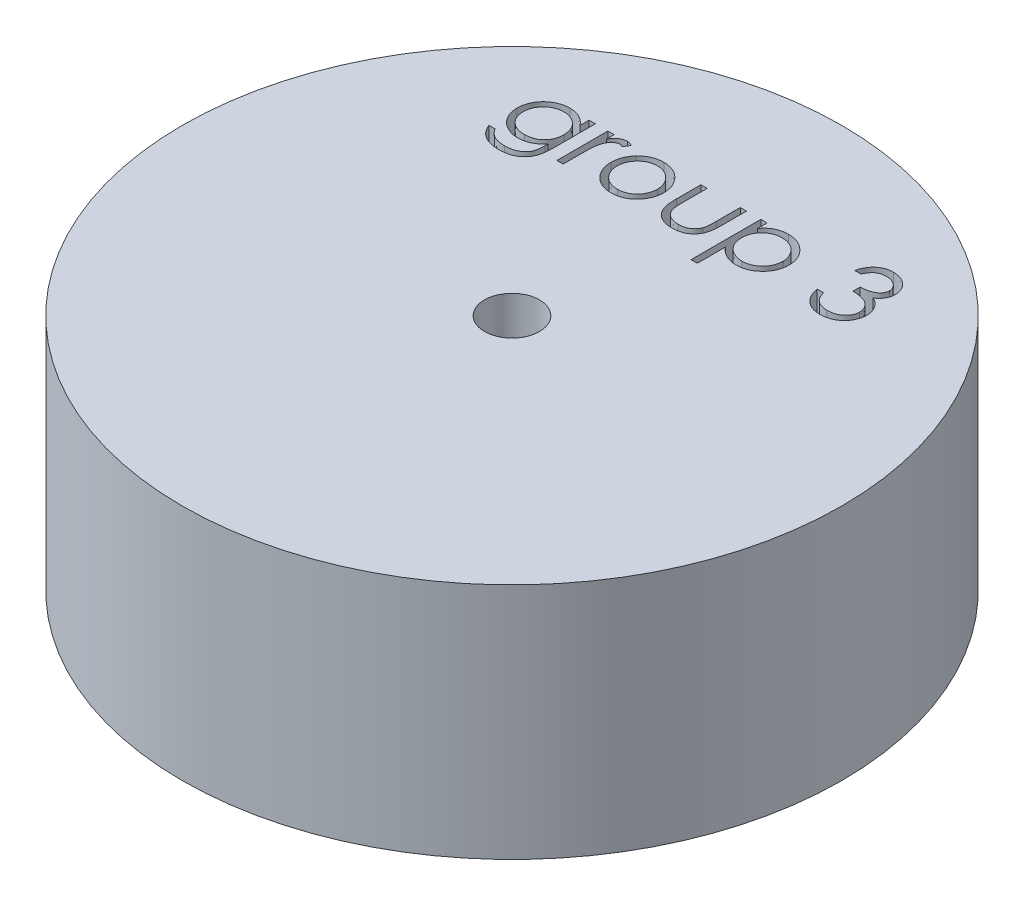
from build123d import *

# Parameters (mm, degrees)
SKETCH1_R           = 15
BOSS_EXTRUDE2_DEPTH = 10.82
SKETCH2_R           = 1.25
CUT_EXTRUDE1_DEPTH  = 7.65
CUT_EXTRUDE2_DEPTH  = 2


with BuildPart() as part:
    # Sketch1 → Boss-Extrude2 (new body)
    with BuildSketch(Plane(origin=(0, 0, 0), x_dir=(1, 0, 0), z_dir=(0, 1, 0))):
        with Locations(Location((0, 0, 0), (0, 0, 270))):
            Circle(SKETCH1_R)
    extrude(amount=BOSS_EXTRUDE2_DEPTH)

    # Sketch2 → Cut-Extrude1 (cut)
    with BuildSketch(Plane(origin=(0, 10.82, 0), x_dir=(1, 0, 0), z_dir=(0, 1, 0))):
        with Locations(Location((0, 0, 0), (0, 0, 270))):
            Circle(SKETCH2_R)
    extrude(amount=-CUT_EXTRUDE1_DEPTH, mode=Mode.SUBTRACT)

    # Sketch3 → Cut-Extrude2 (cut)
    # profile 1 of 6: a face of its own
    with BuildSketch(Plane(origin=(0, 10.82, 0), x_dir=(1, 0, 0), z_dir=(0, 1, 0))):
        with BuildLine():
            Line((-5.949999739, 9.456250615), (-5.665063841, 9.456250615))
            Line((-5.665063841, 9.456250615), (-5.665063841, 7.614979581))
            add(Edge.make_bspline(
                [(-5.665063841, 7.614979581), (-5.665315158, 7.575756906), (-5.665800261, 7.500047695), (-5.669293642, 7.390575255), (-5.676660256, 7.289459592), (-5.685013846, 7.196239543), (-5.69703051, 7.111347201), (-5.711704786, 7.034529251), (-5.728247152, 6.965711976), (-5.742779778, 6.92332587), (-5.749654186, 6.903275855)],
                knots=[0, 0, 0, 0, 1.307562039, 2.523909702, 3.650326591, 4.686913197, 5.643429486, 6.506965704, 7.293745905, 8, 8, 8, 8], degree=3))
            add(Edge.make_bspline(
                [(-5.749654186, 6.903275855), (-5.759804424, 6.877213712), (-5.779801414, 6.825868667), (-5.817253382, 6.753084676), (-5.859194137, 6.684553308), (-5.907097404, 6.620656477), (-5.960746562, 6.561714949), (-6.018877629, 6.506448179), (-6.082622732, 6.456025398), (-6.151945421, 6.411316593), (-6.225247674, 6.371051193), (-6.302487352, 6.336174665), (-6.383228907, 6.305797314), (-6.468230815, 6.283043635), (-6.556160385, 6.263327138), (-6.648051626, 6.250495887), (-6.743367663, 6.24176277), (-6.80817883, 6.240955202), (-6.841060436, 6.240545486)],
                knots=[0, 0, 0, 0, 0.981931301, 1.934503488, 2.87077864, 3.801706999, 4.735015492, 5.667491629, 6.616593066, 7.585388521, 8.561939025, 9.551802639, 10.560317337, 11.588439944, 12.640189604, 13.723962949, 14.845264515, 16, 16, 16, 16], degree=3))
            add(Edge.make_bspline(
                [(-6.841060436, 6.240545486), (-6.889034445, 6.241322441), (-6.982740574, 6.242840043), (-7.119360817, 6.260521088), (-7.249113742, 6.28551684), (-7.370284856, 6.323349621), (-7.482108444, 6.369647462), (-7.583820817, 6.422801455), (-7.674508893, 6.483751756), (-7.756263939, 6.55314873), (-7.830052382, 6.635665784), (-7.899473566, 6.73291045), (-7.966294563, 6.846363985), (-8.005454685, 6.929633089), (-8.025961277, 6.973237794)],
                knots=[0, 0, 0, 0, 1.157897085, 2.2616841, 3.32207898, 4.345638746, 5.321241055, 6.241986252, 7.112515963, 7.955008012, 8.825025602, 9.77857164, 10.836726669, 12, 12, 12, 12], degree=3))
            Line((-8.025961277, 6.973237794), (-7.74102538, 6.973237794))
            add(Edge.make_bspline(
                [(-7.74102538, 6.973237794), (-7.718108947, 6.936856035), (-7.673310143, 6.865734177), (-7.589536878, 6.773647243), (-7.497728282, 6.694949548), (-7.394785998, 6.631530488), (-7.280281695, 6.583715177), (-7.154146487, 6.549629016), (-7.015353973, 6.529221688), (-6.918726736, 6.526762157), (-6.868409194, 6.525481384)],
                knots=[0, 0, 0, 0, 0.997731894, 1.950442991, 2.880492273, 3.800895997, 4.748200782, 5.754801363, 6.83083817, 8, 8, 8, 8], degree=3))
            add(Edge.make_bspline(
                [(-6.868409194, 6.525481384), (-6.8187278, 6.526778733), (-6.722947047, 6.529279893), (-6.585214486, 6.549638123), (-6.459489078, 6.583722595), (-6.346495182, 6.631445917), (-6.24756602, 6.689911643), (-6.162283714, 6.755225996), (-6.093209615, 6.828868763), (-6.046752138, 6.896706545), (-6.017873592, 6.957144148), (-5.999483777, 7.009171146), (-5.984539534, 7.06800197), (-5.972039252, 7.133439388), (-5.96172421, 7.205576892), (-5.955190166, 7.284579422), (-5.950467751, 7.370267431), (-5.95015935, 7.429679063), (-5.949999739, 7.460427297)],
                knots=[0, 0, 0, 0, 1.570740765, 3.028230971, 4.391408896, 5.680370741, 6.894727393, 8.017376726, 9.065722033, 10.075533815, 10.603371122, 11.180248986, 11.817768598, 12.521299649, 13.286540596, 14.121245857, 15.027658897, 16, 16, 16, 16], degree=3))
            Line((-5.949999739, 7.460427297), (-5.949999739, 7.580634629))
            add(Edge.make_bspline(
                [(-5.949999739, 7.580634629), (-5.978920466, 7.546215994), (-6.036253216, 7.477984138), (-6.135265434, 7.388574653), (-6.243412207, 7.311570806), (-6.360509421, 7.248416759), (-6.483688755, 7.197905753), (-6.611616064, 7.162578924), (-6.743144571, 7.1397553), (-6.832273307, 7.137299378), (-6.87731344, 7.136058307)],
                knots=[0, 0, 0, 0, 1.012485704, 2.007162095, 2.997754123, 3.998611389, 4.999708251, 5.992315798, 6.98544096, 8, 8, 8, 8], degree=3))
            add(Edge.make_bspline(
                [(-6.87731344, 7.136058307), (-6.903834913, 7.136525509), (-6.956564005, 7.137454386), (-7.034900097, 7.145581277), (-7.112080209, 7.157372993), (-7.18792434, 7.174682584), (-7.262541932, 7.196900079), (-7.335809676, 7.224673835), (-7.408320804, 7.256074692), (-7.47875727, 7.293061449), (-7.546417546, 7.334211542), (-7.610791292, 7.378787536), (-7.671541324, 7.426556126), (-7.728089425, 7.47798835), (-7.78036142, 7.533009769), (-7.829060357, 7.591033849), (-7.873380951, 7.652870821), (-7.914232668, 7.717393133), (-7.949663446, 7.785030542), (-7.980764269, 7.854316386), (-8.007805658, 7.925102516), (-8.029364272, 7.997625923), (-8.045829925, 8.071840885), (-8.058085631, 8.147625821), (-8.065037005, 8.225214101), (-8.066120971, 8.277484896), (-8.066666405, 8.303786672)],
                knots=[0, 0, 0, 0, 1.028754217, 2.045334182, 3.052854819, 4.056607503, 5.061168794, 6.071104265, 7.095078842, 8.125279047, 9.155117945, 10.165957491, 11.161587969, 12.151493252, 13.128948131, 14.104219989, 15.088194871, 16.07871515, 17.064853787, 18.047899887, 19.02414258, 20.002704429, 20.980574569, 21.971845993, 22.979467364, 24, 24, 24, 24], degree=3))
            add(Edge.make_bspline(
                [(-8.066666405, 8.303786672), (-8.066195447, 8.330096624), (-8.065255355, 8.382614624), (-8.057135538, 8.460519495), (-8.045552967, 8.537381197), (-8.027221633, 8.612407483), (-8.005157631, 8.686452793), (-7.977831247, 8.758970207), (-7.944975658, 8.829981812), (-7.907773957, 8.899540194), (-7.865969101, 8.966711959), (-7.820128922, 9.030508274), (-7.770198079, 9.090459687), (-7.716865413, 9.147171012), (-7.659479722, 9.200095081), (-7.598070693, 9.249103442), (-7.533243651, 9.295017594), (-7.464797682, 9.336847165), (-7.393788908, 9.373842488), (-7.322021373, 9.40759963), (-7.248544403, 9.434391295), (-7.174727885, 9.457997964), (-7.099271819, 9.474721319), (-7.023101398, 9.487622925), (-6.945955849, 9.495483064), (-6.894291437, 9.496464216), (-6.868409194, 9.496955743)],
                knots=[0, 0, 0, 0, 1.008818848, 2.013730394, 3.001654427, 3.987803273, 4.973046549, 5.963777569, 6.957074694, 7.972068341, 8.987420212, 9.989399531, 10.982630087, 11.977756091, 12.973280677, 13.973972381, 14.989194003, 16.018387222, 17.047741039, 18.059210846, 19.057554164, 20.045176975, 21.029480261, 22.018708529, 23.007435371, 24, 24, 24, 24], degree=3))
            add(Edge.make_bspline(
                [(-6.868409194, 9.496955743), (-6.82572727, 9.495725046), (-6.741443587, 9.493294799), (-6.617409035, 9.474225617), (-6.497718574, 9.443823619), (-6.381696803, 9.400266583), (-6.268398605, 9.340803334), (-6.158197389, 9.262477945), (-6.050774317, 9.164587851), (-5.984482285, 9.089519182), (-5.949999739, 9.050471368)],
                knots=[0, 0, 0, 0, 0.96728863, 1.910097829, 2.838038873, 3.762875196, 4.71315279, 5.730631239, 6.819562287, 8, 8, 8, 8], degree=3))
            Line((-5.949999739, 9.050471368), (-5.949999739, 9.456250615))
        make_face()
        with BuildLine():
            add(Edge.make_bspline(
                [(-6.845512559, 9.212019845), (-6.887178269, 9.210603736), (-6.96966754, 9.207800139), (-7.090579108, 9.183865435), (-7.207307469, 9.146358798), (-7.317620964, 9.092707996), (-7.420950985, 9.027308223), (-7.512640287, 8.948078105), (-7.592836175, 8.857594055), (-7.660674983, 8.756674188), (-7.714678437, 8.647796839), (-7.752908539, 8.53303353), (-7.777628203, 8.414238643), (-7.780356573, 8.333164925), (-7.781730508, 8.292338355)],
                knots=[0, 0, 0, 0, 1.026226791, 2.031711442, 3.026614839, 4.04107745, 5.047145931, 6.032893242, 7.017642609, 8.019221815, 9.021877557, 10.003543541, 10.994637589, 12, 12, 12, 12], degree=3))
            add(Edge.make_bspline(
                [(-7.781730508, 8.292338355), (-7.781072143, 8.261556029), (-7.779777331, 8.201016196), (-7.767328085, 8.112172534), (-7.747206781, 8.027553964), (-7.718688744, 7.947155367), (-7.683353085, 7.870515589), (-7.638910006, 7.798162569), (-7.586612339, 7.730031871), (-7.526869418, 7.66662741), (-7.461032271, 7.608877817), (-7.389622712, 7.558134023), (-7.312737593, 7.516631583), (-7.232267843, 7.480762395), (-7.146260943, 7.454564955), (-7.055955701, 7.434572634), (-6.960713233, 7.42313469), (-6.895787441, 7.421717009), (-6.862685035, 7.420994204)],
                knots=[0, 0, 0, 0, 1.039728707, 2.044842319, 3.024901384, 3.974314358, 4.923051295, 5.871625912, 6.837440708, 7.820715446, 8.810779094, 9.792721783, 10.773906224, 11.758876063, 12.764959493, 13.806266761, 14.881525401, 16, 16, 16, 16], degree=3))
            add(Edge.make_bspline(
                [(-6.862685035, 7.420994204), (-6.829153626, 7.421690535), (-6.76358331, 7.423052203), (-6.667815389, 7.43475752), (-6.577071404, 7.453646027), (-6.491434558, 7.480463914), (-6.410581512, 7.514682931), (-6.335420541, 7.557986862), (-6.264340048, 7.607303169), (-6.199609591, 7.664826924), (-6.141076955, 7.728222598), (-6.090067617, 7.797206182), (-6.046602367, 7.870739653), (-6.010609052, 7.948814722), (-5.983130602, 8.032038142), (-5.964698453, 8.120201865), (-5.951810905, 8.212883507), (-5.950612638, 8.276391323), (-5.949999739, 8.308874813)],
                knots=[0, 0, 0, 0, 1.121943988, 2.193949579, 3.223793937, 4.220241907, 5.192961521, 6.155822191, 7.11847367, 8.083710714, 9.04790392, 10.001595906, 10.949595423, 11.902125208, 12.873731292, 13.87582262, 14.913508608, 16, 16, 16, 16], degree=3))
            add(Edge.make_bspline(
                [(-5.949999739, 8.308874813), (-5.951214918, 8.351163866), (-5.953588952, 8.433781816), (-5.975992802, 8.554165813), (-6.012115422, 8.667348824), (-6.062776404, 8.772972888), (-6.126260083, 8.869918836), (-6.202723925, 8.956391181), (-6.290849253, 9.032501244), (-6.390382872, 9.095908891), (-6.497468769, 9.147131106), (-6.609520139, 9.185559285), (-6.72637063, 9.207325557), (-6.805570015, 9.210446077), (-6.845512559, 9.212019845)],
                knots=[0, 0, 0, 0, 1.070913519, 2.092188694, 3.091357305, 4.074328408, 5.051968682, 6.018948707, 6.99050112, 7.9935919, 9.000589572, 9.992915277, 10.987769056, 12, 12, 12, 12], degree=3))
        make_face(mode=Mode.SUBTRACT)
    # profile 2 of 6: a face of its own
    with BuildSketch(Plane(origin=(0, 10.82, 0), x_dir=(1, 0, 0), z_dir=(0, 1, 0))):
        with BuildLine():
            Line((-5.095192046, 9.456250615), (-4.810256149, 9.456250615))
            Line((-4.810256149, 9.456250615), (-4.810256149, 9.114709148))
            add(Edge.make_bspline(
                [(-4.810256149, 9.114709148), (-4.789220632, 9.146509792), (-4.748990369, 9.207328278), (-4.682122212, 9.287764001), (-4.613629904, 9.354361936), (-4.543185556, 9.407432985), (-4.470271137, 9.447177743), (-4.396486902, 9.47629071), (-4.320672011, 9.493505846), (-4.269725123, 9.495804237), (-4.24420046, 9.496955743)],
                knots=[0, 0, 0, 0, 1.2804753, 2.448899062, 3.506932113, 4.484331642, 5.4025378, 6.288909075, 7.142734305, 8, 8, 8, 8], degree=3))
            add(Edge.make_bspline(
                [(-4.24420046, 9.496955743), (-4.224400863, 9.495875765), (-4.183661908, 9.493653641), (-4.121991987, 9.478040964), (-4.05845257, 9.453114472), (-4.017501976, 9.429673699), (-3.996153585, 9.417453539)],
                knots=[0, 0, 0, 0, 0.901110191, 1.854092781, 2.881294221, 4, 4, 4, 4], degree=3))
            Line((-3.996153585, 9.417453539), (-4.152613921, 9.170678699))
            add(Edge.make_bspline(
                [(-4.152613921, 9.170678699), (-4.166319962, 9.176793084), (-4.192336651, 9.188399356), (-4.230395436, 9.202135322), (-4.265484934, 9.210223331), (-4.287840162, 9.211448625), (-4.298261958, 9.212019845)],
                knots=[0, 0, 0, 0, 1.180555205, 2.24091978, 3.179933427, 4, 4, 4, 4], degree=3))
            add(Edge.make_bspline(
                [(-4.298261958, 9.212019845), (-4.321127159, 9.210495811), (-4.367765541, 9.207387224), (-4.436240766, 9.182949877), (-4.502686445, 9.143466266), (-4.555456453, 9.099677472), (-4.596316211, 9.05745197), (-4.625471987, 9.020578062), (-4.652217051, 8.979231732), (-4.677771465, 8.934119804), (-4.70105446, 8.884472016), (-4.722784767, 8.830784386), (-4.74243245, 8.772994734), (-4.753635886, 8.732733448), (-4.759374739, 8.71210999)],
                knots=[0, 0, 0, 0, 1.125678352, 2.296057538, 3.5422874, 4.923748041, 5.663163013, 6.437101912, 7.23742474, 8.08941207, 8.991984279, 9.93940061, 10.944477711, 12, 12, 12, 12], degree=3))
            add(Edge.make_bspline(
                [(-4.759374739, 8.71210999), (-4.763667695, 8.693715696), (-4.773176269, 8.652973735), (-4.782421449, 8.584621859), (-4.791555941, 8.503864683), (-4.797993587, 8.410477416), (-4.803960811, 8.304693271), (-4.807326386, 8.186351091), (-4.810141378, 8.055329409), (-4.810216731, 7.963731245), (-4.810256149, 7.915815919)],
                knots=[0, 0, 0, 0, 0.566838948, 1.255505196, 2.06880316, 3.007127437, 4.065329342, 5.249902469, 6.561414163, 8, 8, 8, 8], degree=3))
            Line((-4.810256149, 7.915815919), (-4.810256149, 7.136058307))
            Line((-4.810256149, 7.136058307), (-5.095192046, 7.136058307))
            Line((-5.095192046, 7.136058307), (-5.095192046, 9.456250615))
        make_face()
    # profile 3 of 6: a face of its own
    with BuildSketch(Plane(origin=(0, 10.82, 0), x_dir=(1, 0, 0), z_dir=(0, 1, 0))):
        with BuildLine():
            add(Edge.make_bspline(
                [(-2.590554626, 9.496955743), (-2.547019686, 9.496028741), (-2.461658307, 9.494211119), (-2.336646868, 9.474784685), (-2.217316638, 9.445078148), (-2.103210592, 9.404010374), (-1.995790095, 9.348963176), (-1.893490467, 9.283277604), (-1.79659218, 9.205460537), (-1.738514146, 9.14526429), (-1.709034194, 9.114709148)],
                knots=[0, 0, 0, 0, 1.054011418, 2.066658804, 3.057071809, 4.030435133, 4.997543892, 5.974964718, 6.972108034, 8, 8, 8, 8], degree=3))
            add(Edge.make_bspline(
                [(-1.709034194, 9.114709148), (-1.683650564, 9.085486461), (-1.633374548, 9.027606626), (-1.568907788, 8.933757606), (-1.513371087, 8.836566229), (-1.468863973, 8.734741868), (-1.43377113, 8.629173417), (-1.40885582, 8.519498021), (-1.394035886, 8.405957892), (-1.39203748, 8.328847267), (-1.39102538, 8.289794284)],
                knots=[0, 0, 0, 0, 1.025258237, 2.030674902, 3.01204498, 3.988269485, 4.97094183, 5.956517959, 6.965070386, 8, 8, 8, 8], degree=3))
            add(Edge.make_bspline(
                [(-1.39102538, 8.289794284), (-1.391915593, 8.250514946), (-1.393674695, 8.172897143), (-1.410314976, 8.058579575), (-1.436196747, 7.947731414), (-1.473237057, 7.840816742), (-1.520733342, 7.737508749), (-1.578691323, 7.638258658), (-1.647517718, 7.542870651), (-1.72553563, 7.452154698), (-1.81176126, 7.368546774), (-1.905302338, 7.295677558), (-2.00432064, 7.233246604), (-2.110132824, 7.182957856), (-2.221772616, 7.143306913), (-2.339480813, 7.115457613), (-2.463074556, 7.098619514), (-2.547463535, 7.096457272), (-2.590554626, 7.095353179)],
                knots=[0, 0, 0, 0, 0.998656419, 1.973391657, 2.932242238, 3.890759089, 4.846373663, 5.82037756, 6.809684879, 7.83454468, 8.860553229, 9.859544525, 10.845671541, 11.83227036, 12.833544569, 13.85385346, 14.904124723, 16, 16, 16, 16], degree=3))
            add(Edge.make_bspline(
                [(-2.590554626, 7.095353179), (-2.633856836, 7.096460978), (-2.718666402, 7.098630659), (-2.8426964, 7.115392194), (-2.960615554, 7.143294078), (-3.072401497, 7.183088161), (-3.178668608, 7.233248212), (-3.278260645, 7.295488816), (-3.371877711, 7.368568385), (-3.458121582, 7.452148842), (-3.536134603, 7.54287216), (-3.604962261, 7.638258266), (-3.662919914, 7.737508851), (-3.710416284, 7.840816715), (-3.747456572, 7.947731422), (-3.773338349, 8.058579573), (-3.789978627, 8.172897143), (-3.79173773, 8.250514947), (-3.792627944, 8.289794284)],
                knots=[0, 0, 0, 0, 1.099876186, 2.154163076, 3.173186993, 4.173200201, 5.163417411, 6.152872554, 7.150605724, 8.17532212, 9.198891216, 10.186952605, 11.159729845, 12.11414092, 13.071450619, 14.029093627, 15.002601286, 16, 16, 16, 16], degree=3))
            add(Edge.make_bspline(
                [(-3.792627944, 8.289794284), (-3.791608941, 8.328635008), (-3.78959149, 8.405532966), (-3.774786457, 8.518859657), (-3.749968338, 8.628349431), (-3.714833428, 8.733510399), (-3.669916076, 8.834888544), (-3.615159765, 8.932320069), (-3.550035405, 9.025744717), (-3.499959349, 9.083549747), (-3.47461913, 9.112801095)],
                knots=[0, 0, 0, 0, 1.031353054, 2.041901799, 3.029428768, 4.008703097, 4.981709435, 5.96992636, 6.972712378, 8, 8, 8, 8], degree=3))
            add(Edge.make_bspline(
                [(-3.47461913, 9.112801095), (-3.445183622, 9.143621219), (-3.387293517, 9.204234415), (-3.289912885, 9.281824633), (-3.187864919, 9.348877071), (-3.079257307, 9.402830495), (-2.965245001, 9.445319722), (-2.845303259, 9.474861297), (-2.719867613, 9.494141126), (-2.634088528, 9.496008187), (-2.590554626, 9.496955743)],
                knots=[0, 0, 0, 0, 1.027980169, 2.021703884, 2.998553061, 3.971491411, 4.943284454, 5.930300938, 6.949603206, 8, 8, 8, 8], degree=3))
        make_face()
        with BuildLine():
            add(Edge.make_bspline(
                [(-2.591826662, 9.212019845), (-2.622612923, 9.211144823), (-2.683390704, 9.209417367), (-2.772852756, 9.196278396), (-2.858977039, 9.175461731), (-2.941926947, 9.145885195), (-3.021422754, 9.107695479), (-3.097540569, 9.06078861), (-3.170504282, 9.005785856), (-3.238886582, 8.94277329), (-3.301644823, 8.873940202), (-3.356506987, 8.800599191), (-3.403156905, 8.723939862), (-3.442019049, 8.643882499), (-3.470963427, 8.55961581), (-3.491984669, 8.472094094), (-3.505111244, 8.381139038), (-3.506822459, 8.319307257), (-3.507692046, 8.287886231)],
                knots=[0, 0, 0, 0, 1.021534396, 2.016698045, 2.994645724, 3.958388632, 4.93408049, 5.916473867, 6.921342795, 7.962252576, 8.998418191, 10.008913653, 10.997312074, 11.973003931, 12.956656626, 13.948281152, 14.957379055, 16, 16, 16, 16], degree=3))
            add(Edge.make_bspline(
                [(-3.507692046, 8.287886231), (-3.506234428, 8.24728975), (-3.503341327, 8.166713325), (-3.479814363, 8.048048949), (-3.440456809, 7.934128269), (-3.387309777, 7.825619119), (-3.32071985, 7.725223552), (-3.242263725, 7.63571442), (-3.152783425, 7.55843872), (-3.0533456, 7.494321096), (-2.945981326, 7.443376174), (-2.832355949, 7.407272818), (-2.713846177, 7.383803497), (-2.632855799, 7.381470802), (-2.591826662, 7.380289076)],
                knots=[0, 0, 0, 0, 1.016792936, 2.018143844, 3.017858371, 4.030088057, 5.03801393, 6.028138512, 7.003788237, 7.991172063, 8.984598303, 9.972568034, 10.972917682, 12, 12, 12, 12], degree=3))
            add(Edge.make_bspline(
                [(-2.591826662, 7.380289076), (-2.550799884, 7.381477687), (-2.469814165, 7.383823973), (-2.351469054, 7.407154617), (-2.238154237, 7.443534366), (-2.130901478, 7.494263799), (-2.031508917, 7.558682204), (-1.941385071, 7.635278061), (-1.863598831, 7.725460626), (-1.797074775, 7.825752098), (-1.743057373, 7.933960046), (-1.70388404, 8.048069975), (-1.680300515, 8.16670797), (-1.677415049, 8.247287956), (-1.675961277, 8.287886231)],
                knots=[0, 0, 0, 0, 1.02726834, 2.027799167, 3.010890988, 4.004497153, 4.992059811, 5.971914811, 6.958719428, 7.966827853, 8.981595046, 9.981490638, 10.983022906, 12, 12, 12, 12], degree=3))
            add(Edge.make_bspline(
                [(-1.675961277, 8.287886231), (-1.676830565, 8.319307445), (-1.67854119, 8.381139595), (-1.691672051, 8.472091964), (-1.712677433, 8.559623626), (-1.741680258, 8.643853658), (-1.780373542, 8.724147144), (-1.827923061, 8.800374111), (-1.882561206, 8.874194263), (-1.946076737, 8.94255078), (-2.014387658, 9.00581042), (-2.087380943, 9.060809938), (-2.163385888, 9.107489328), (-2.242650745, 9.146211846), (-2.325611288, 9.175192648), (-2.411614898, 9.196398592), (-2.500695247, 9.209361842), (-2.561255236, 9.211128177), (-2.591826662, 9.212019845)],
                knots=[0, 0, 0, 0, 1.042956736, 2.052379634, 3.044323526, 4.02829302, 5.004299113, 5.996692471, 7.007513377, 8.048758398, 9.090003419, 10.095195979, 11.07790575, 12.047570684, 13.018257071, 13.989683339, 14.985167495, 16, 16, 16, 16], degree=3))
        make_face(mode=Mode.SUBTRACT)
    # profile 4 of 6: a face of its own
    with BuildSketch(Plane(origin=(0, 10.82, 0), x_dir=(1, 0, 0), z_dir=(0, 1, 0))):
        with BuildLine():
            Line((-0.861858713, 9.456250615), (-0.576922815, 9.456250615))
            Line((-0.576922815, 9.456250615), (-0.576922815, 8.380108788))
            add(Edge.make_bspline(
                [(-0.576922815, 8.380108788), (-0.576794087, 8.348519579), (-0.576547837, 8.288090904), (-0.57487784, 8.201136556), (-0.570949827, 8.121837109), (-0.566038715, 8.050146755), (-0.559723063, 7.986077622), (-0.552208871, 7.92985349), (-0.54381016, 7.880836766), (-0.535588984, 7.851315294), (-0.531765564, 7.837585751)],
                knots=[0, 0, 0, 0, 1.388932606, 2.656963016, 3.823490214, 4.879454478, 5.816252168, 6.653371382, 7.373723809, 8, 8, 8, 8], degree=3))
            add(Edge.make_bspline(
                [(-0.531765564, 7.837585751), (-0.525631958, 7.820329289), (-0.513492263, 7.786175124), (-0.491472746, 7.736836526), (-0.464232755, 7.691138949), (-0.434424197, 7.647320254), (-0.40004402, 7.606678452), (-0.361527214, 7.569282173), (-0.320163099, 7.533718462), (-0.258699613, 7.491640829), (-0.174644422, 7.446541923), (-0.064287994, 7.407629288), (0.055367982, 7.384373937), (0.138067406, 7.381675862), (0.18057418, 7.380289076)],
                knots=[0, 0, 0, 0, 0.725840625, 1.436591201, 2.137033971, 2.831655856, 3.53531722, 4.242432219, 4.957935707, 5.694543706, 7.190802206, 8.724350549, 10.316345118, 12, 12, 12, 12], degree=3))
            add(Edge.make_bspline(
                [(0.18057418, 7.380289076), (0.223077005, 7.381705352), (0.305312107, 7.384445583), (0.4236534, 7.406927793), (0.531831469, 7.444488668), (0.628760546, 7.496928248), (0.714000987, 7.561101405), (0.785034281, 7.636402253), (0.843642291, 7.720448483), (0.869232265, 7.783154079), (0.882101624, 7.814689116)],
                knots=[0, 0, 0, 0, 1.157059328, 2.238695713, 3.266970494, 4.264342957, 5.228770407, 6.160125903, 7.074715775, 8, 8, 8, 8], degree=3))
            add(Edge.make_bspline(
                [(0.882101624, 7.814689116), (0.88590639, 7.827358544), (0.894317798, 7.855367555), (0.903355074, 7.90288347), (0.911496192, 7.95954779), (0.918447788, 8.025731308), (0.923405471, 8.101261067), (0.926077938, 8.186113465), (0.929097159, 8.280022128), (0.929142985, 8.345760738), (0.929166928, 8.380108788)],
                knots=[0, 0, 0, 0, 0.557542046, 1.232589297, 2.036731608, 2.971723315, 4.038036528, 5.22795436, 6.551621927, 8, 8, 8, 8], degree=3))
            Line((0.929166928, 8.380108788), (0.929166928, 9.456250615))
            Line((0.929166928, 9.456250615), (1.214102826, 9.456250615))
            Line((1.214102826, 9.456250615), (1.214102826, 8.326683307))
            add(Edge.make_bspline(
                [(1.214102826, 8.326683307), (1.213702145, 8.288304658), (1.212924771, 8.213844831), (1.207928823, 8.105637101), (1.199356675, 8.004797065), (1.186345811, 7.911271344), (1.171046234, 7.825131342), (1.151310187, 7.746266659), (1.127744214, 7.674920278), (1.101159925, 7.609840238), (1.069752945, 7.550833412), (1.036345577, 7.494830207), (0.997769534, 7.443220187), (0.957156536, 7.393434249), (0.911979319, 7.34794872), (0.863084447, 7.305719881), (0.811160116, 7.266102203), (0.755054058, 7.230640828), (0.695585344, 7.198694299), (0.632680559, 7.170376857), (0.565569225, 7.147968091), (0.495117212, 7.128636273), (0.420979348, 7.113473861), (0.343227105, 7.102781761), (0.261886675, 7.096227354), (0.206451665, 7.095649463), (0.178030109, 7.095353179)],
                knots=[0, 0, 0, 0, 1.493040784, 2.896703357, 4.213163133, 5.428574705, 6.569057535, 7.615249723, 8.588095153, 9.490268104, 10.346124644, 11.18633936, 12.024365274, 12.850166724, 13.684164916, 14.514361689, 15.362232829, 16.222528818, 17.093394965, 17.986930858, 18.902426812, 19.842810585, 20.827885679, 21.843828298, 22.894529745, 24, 24, 24, 24], degree=3))
            add(Edge.make_bspline(
                [(0.178030109, 7.095353179), (0.149821129, 7.095661342), (0.094387856, 7.09626691), (0.013043227, 7.10274555), (-0.064924437, 7.113457248), (-0.139237942, 7.128747338), (-0.209971859, 7.14783278), (-0.277412706, 7.170514559), (-0.340770795, 7.198708996), (-0.400807327, 7.230438637), (-0.457052351, 7.266329994), (-0.509765132, 7.305671001), (-0.558874991, 7.34840293), (-0.60439276, 7.394347318), (-0.645679532, 7.44407411), (-0.683249798, 7.497183297), (-0.717681952, 7.553148649), (-0.74884484, 7.613077375), (-0.775616219, 7.678910555), (-0.799252049, 7.751751493), (-0.818583842, 7.832398777), (-0.834315939, 7.920783454), (-0.846971888, 8.016482528), (-0.855758603, 8.12004959), (-0.860671535, 8.231232368), (-0.861454455, 8.308021911), (-0.861858713, 8.347671889)],
                knots=[0, 0, 0, 0, 1.083640291, 2.129454052, 3.13281866, 4.105697902, 5.042300162, 5.946461698, 6.836384745, 7.703652036, 8.553297018, 9.397182691, 10.228592656, 11.052265423, 11.879314572, 12.708807002, 13.549817954, 14.402308542, 15.300838682, 16.27712199, 17.341985831, 18.484375296, 19.725102775, 21.0496083, 22.476576903, 24, 24, 24, 24], degree=3))
            Line((-0.861858713, 8.347671889), (-0.861858713, 9.456250615))
        make_face()
    # profile 5 of 6: a face of its own
    with BuildSketch(Plane(origin=(0, 10.82, 0), x_dir=(1, 0, 0), z_dir=(0, 1, 0))):
        with BuildLine():
            Line((1.865384877, 9.456250615), (2.150320774, 9.456250615))
            Line((2.150320774, 9.456250615), (2.150320774, 9.026938715))
            add(Edge.make_bspline(
                [(2.150320774, 9.026938715), (2.180580778, 9.065889374), (2.239385039, 9.141582184), (2.340735488, 9.239544658), (2.44771195, 9.322162969), (2.563067332, 9.386917124), (2.685008822, 9.435740289), (2.813035996, 9.471825933), (2.948235447, 9.493090699), (3.040670086, 9.495650349), (3.087810758, 9.496955743)],
                knots=[0, 0, 0, 0, 1.0828784, 2.104357462, 3.088488658, 4.04616522, 5.001424249, 5.969181776, 6.964304535, 8, 8, 8, 8], degree=3))
            add(Edge.make_bspline(
                [(3.087810758, 9.496955743), (3.128987427, 9.495764502), (3.210375276, 9.493409952), (3.33017549, 9.477468681), (3.445541731, 9.450147631), (3.555821323, 9.410776801), (3.662195675, 9.362103625), (3.763090008, 9.300674599), (3.860075877, 9.229548984), (3.950714134, 9.147695532), (4.034462803, 9.059132748), (4.106894696, 8.963862515), (4.169371352, 8.865017883), (4.219872264, 8.761066485), (4.259431265, 8.652826898), (4.287566008, 8.539861812), (4.304309727, 8.422590066), (4.306556223, 8.342849741), (4.307692569, 8.302514637)],
                knots=[0, 0, 0, 0, 1.041296284, 2.058176809, 3.050446431, 4.034000596, 5.01514041, 6.003636468, 7.015969324, 8.052561599, 9.08815499, 10.094063707, 11.074456064, 12.040834395, 13.011057502, 13.983766392, 14.980127149, 16, 16, 16, 16], degree=3))
            add(Edge.make_bspline(
                [(4.307692569, 8.302514637), (4.306580879, 8.261328257), (4.304388465, 8.180102772), (4.287384066, 8.060825191), (4.260208902, 7.946083074), (4.221148979, 7.83606727), (4.1706742, 7.730853529), (4.109256492, 7.630517727), (4.036788054, 7.535092011), (3.953964888, 7.44587188), (3.864109724, 7.36368536), (3.768063716, 7.291805112), (3.667317405, 7.231442578), (3.562386225, 7.181020893), (3.452371896, 7.143018698), (3.337787708, 7.115606836), (3.218696047, 7.098702686), (3.137687144, 7.096478243), (3.096715005, 7.095353179)],
                knots=[0, 0, 0, 0, 1.038740735, 2.04854663, 3.033179607, 4.009277356, 4.987731542, 5.972001279, 6.972200261, 8.005528982, 9.039189865, 10.040446548, 11.026516639, 11.997840187, 12.972163198, 13.956796175, 14.96660207, 16, 16, 16, 16], degree=3))
            add(Edge.make_bspline(
                [(3.096715005, 7.095353179), (3.050607136, 7.096527754), (2.959530578, 7.098847885), (2.826364119, 7.122360493), (2.698205832, 7.157500427), (2.576475584, 7.208934515), (2.460209068, 7.27448059), (2.350063959, 7.354409134), (2.24545519, 7.448552986), (2.182491532, 7.519973991), (2.150320774, 7.556465959)],
                knots=[0, 0, 0, 0, 1.014726462, 2.004382257, 2.969841629, 3.936926163, 4.907207904, 5.903978561, 6.929055279, 8, 8, 8, 8], degree=3))
            Line((2.150320774, 7.556465959), (2.150320774, 6.281250615))
            Line((2.150320774, 6.281250615), (1.865384877, 6.281250615))
            Line((1.865384877, 6.281250615), (1.865384877, 9.456250615))
        make_face()
        with BuildLine():
            add(Edge.make_bspline(
                [(3.085266688, 9.212019845), (3.052990942, 9.21143904), (2.989448317, 9.210295583), (2.896309947, 9.196712072), (2.806597666, 9.176992836), (2.72121561, 9.14713704), (2.639345408, 9.110489546), (2.56161763, 9.06469515), (2.488086837, 9.010582259), (2.418938031, 8.949187425), (2.356469186, 8.88153753), (2.301167101, 8.809340017), (2.25471476, 8.732686319), (2.216159356, 8.652290454), (2.186819378, 8.567522231), (2.165995261, 8.478864427), (2.152904869, 8.386220002), (2.151191333, 8.323122768), (2.150320774, 8.29106632)],
                knots=[0, 0, 0, 0, 1.05670511, 2.080379991, 3.077984906, 4.06214886, 5.038337365, 6.01289324, 7.01187578, 8.025460281, 9.038092164, 10.024533457, 11.000252242, 11.969694649, 12.940728589, 13.933144304, 14.949937299, 16, 16, 16, 16], degree=3))
            add(Edge.make_bspline(
                [(2.150320774, 8.29106632), (2.151763908, 8.248985675), (2.154591129, 8.166546127), (2.177575742, 8.04609196), (2.214982017, 7.932107958), (2.268075921, 7.825554017), (2.335156935, 7.72759816), (2.415981691, 7.639885966), (2.509818863, 7.562968787), (2.615108387, 7.498179507), (2.727977034, 7.445576047), (2.845711397, 7.407916728), (2.966692396, 7.384719063), (3.048487943, 7.381773735), (3.089718811, 7.380289076)],
                knots=[0, 0, 0, 0, 1.03728447, 2.032128127, 3.01272805, 3.987917167, 4.958271349, 5.931593992, 6.91984656, 7.941419022, 8.973179163, 9.983609215, 10.983593296, 12, 12, 12, 12], degree=3))
            add(Edge.make_bspline(
                [(3.089718811, 7.380289076), (3.130119115, 7.381700932), (3.210306455, 7.384503213), (3.328378465, 7.408758569), (3.443123544, 7.445810841), (3.552144129, 7.499839867), (3.65449115, 7.566052277), (3.746912274, 7.645481736), (3.82765426, 7.737547613), (3.896474068, 7.840062469), (3.951929058, 7.949985853), (3.993594347, 8.063724684), (4.01764141, 8.180878032), (4.021049354, 8.259797386), (4.022756672, 8.299334549)],
                knots=[0, 0, 0, 0, 1.00104056, 1.986885549, 2.97790532, 3.984399681, 4.995088187, 5.994304198, 6.996462723, 8.023150851, 9.048424203, 10.043036403, 11.019596776, 12, 12, 12, 12], degree=3))
            add(Edge.make_bspline(
                [(4.022756672, 8.299334549), (4.02143702, 8.339117289), (4.018807999, 8.418372822), (3.992911758, 8.535179169), (3.953995349, 8.649377548), (3.897245352, 8.757799761), (3.829934201, 8.860101964), (3.748520853, 8.950411554), (3.657247589, 9.029487807), (3.555022419, 9.094816072), (3.445312176, 9.1467822), (3.32981936, 9.184776644), (3.209129806, 9.207612831), (3.126917576, 9.210537918), (3.085266688, 9.212019845)],
                knots=[0, 0, 0, 0, 0.983928682, 1.960191568, 2.949917689, 3.96440592, 4.982380491, 5.975291189, 6.965713506, 7.964880129, 8.970154049, 9.96478489, 10.968906225, 12, 12, 12, 12], degree=3))
        make_face(mode=Mode.SUBTRACT)
    # profile 6 of 6: a face of its own
    with BuildSketch(Plane(origin=(0, 10.82, 0), x_dir=(1, 0, 0), z_dir=(0, 1, 0))):
        with BuildLine():
            Line((6.302243851, 9.578365999), (6.017307954, 9.578365999))
            add(Edge.make_bspline(
                [(6.017307954, 9.578365999), (6.025027332, 9.610326895), (6.040118085, 9.672807833), (6.071593741, 9.762077277), (6.105883065, 9.846553614), (6.147057467, 9.924655052), (6.19196898, 9.9979512), (6.243424591, 10.06477962), (6.29905034, 10.126839953), (6.360577258, 10.181915533), (6.425101115, 10.231788187), (6.493531092, 10.274310561), (6.564490431, 10.310890328), (6.638470773, 10.341025824), (6.715692372, 10.363727549), (6.795457102, 10.380198365), (6.877973991, 10.39089459), (6.933987877, 10.391938497), (6.962430149, 10.392468563)],
                knots=[0, 0, 0, 0, 1.162005537, 2.271625781, 3.343758855, 4.383309926, 5.390229558, 6.379919256, 7.361854164, 8.333198761, 9.295911338, 10.242430842, 11.177959212, 12.116337295, 13.062827104, 14.020064771, 14.994644689, 16, 16, 16, 16], degree=3))
            add(Edge.make_bspline(
                [(6.962430149, 10.392468563), (7.003870922, 10.391217404), (7.085848525, 10.388742378), (7.206283575, 10.366141425), (7.322422189, 10.330377198), (7.43299315, 10.280961745), (7.535698442, 10.220013254), (7.627080555, 10.147473814), (7.705900847, 10.064743019), (7.772026461, 9.973364193), (7.823801638, 9.875705267), (7.861979991, 9.775193696), (7.885222516, 9.672067907), (7.888234736, 9.60243809), (7.889743851, 9.567553699)],
                knots=[0, 0, 0, 0, 1.083050992, 2.142477498, 3.193116406, 4.255571735, 5.30263384, 6.308962982, 7.297363603, 8.282367274, 9.249857812, 10.179914175, 11.08814088, 12, 12, 12, 12], degree=3))
            add(Edge.make_bspline(
                [(7.889743851, 9.567553699), (7.888688308, 9.53398325), (7.886622773, 9.46829109), (7.869084341, 9.372386589), (7.839569302, 9.281997423), (7.798684589, 9.196743083), (7.745760468, 9.117164121), (7.681650236, 9.043081492), (7.605901393, 8.974166612), (7.548498356, 8.934688233), (7.518945574, 8.914363595)],
                knots=[0, 0, 0, 0, 1.024540389, 2.004866551, 2.965041327, 3.920577974, 4.882998113, 5.874504559, 6.905732034, 8, 8, 8, 8], degree=3))
            add(Edge.make_bspline(
                [(7.518945574, 8.914363595), (7.552720094, 8.898054825), (7.619637187, 8.865742435), (7.710850882, 8.802373284), (7.793652955, 8.729206454), (7.8398299, 8.672108476), (7.863031111, 8.643420086)],
                knots=[0, 0, 0, 0, 1.015518401, 2.012035669, 3.001164323, 4, 4, 4, 4], degree=3))
            add(Edge.make_bspline(
                [(7.863031111, 8.643420086), (7.878308614, 8.622503411), (7.908613441, 8.581012587), (7.946019961, 8.514304543), (7.979955372, 8.446857121), (8.006398785, 8.376862517), (8.026876507, 8.305131997), (8.041514194, 8.231542395), (8.050607522, 8.156033618), (8.051909772, 8.104950153), (8.052564364, 8.079272449)],
                knots=[0, 0, 0, 0, 1.025084078, 2.033381695, 3.024893161, 4.013698104, 4.991890475, 5.976764909, 6.982997093, 8, 8, 8, 8], degree=3))
            add(Edge.make_bspline(
                [(8.052564364, 8.079272449), (8.050936484, 8.034813631), (8.047688385, 7.946105218), (8.018656117, 7.815046006), (7.97364982, 7.6869343), (7.909735314, 7.564402125), (7.831841217, 7.449757065), (7.73916993, 7.347180699), (7.632774402, 7.259007679), (7.514114992, 7.185338401), (7.385557311, 7.126448571), (7.248056596, 7.085575034), (7.103594047, 7.05895402), (7.004527427, 7.05609936), (6.95416192, 7.05464805)],
                knots=[0, 0, 0, 0, 0.955779014, 1.907060117, 2.875433937, 3.871313158, 4.872415639, 5.851225146, 6.836215519, 7.83643374, 8.849228613, 9.86973379, 10.916971861, 12, 12, 12, 12], degree=3))
            add(Edge.make_bspline(
                [(6.95416192, 7.05464805), (6.920217269, 7.055435644), (6.853425515, 7.056985365), (6.755233199, 7.067579525), (6.661505657, 7.086928887), (6.572116165, 7.112966885), (6.486985311, 7.145979394), (6.406372872, 7.187089927), (6.329782897, 7.235451076), (6.257938135, 7.291633687), (6.190847148, 7.35448176), (6.130292891, 7.425111005), (6.075265793, 7.502215792), (6.027239257, 7.586691708), (5.984025735, 7.677447048), (5.948483011, 7.7756439), (5.917199673, 7.880404406), (5.902655031, 7.953409213), (5.895192569, 7.990865999)],
                knots=[0, 0, 0, 0, 1.048658725, 2.063410685, 3.046034179, 4.001477787, 4.936774919, 5.862367409, 6.792675028, 7.730719943, 8.675894397, 9.627829632, 10.600096036, 11.597688215, 12.626045268, 13.701542398, 14.82072376, 16, 16, 16, 16], degree=3))
            Line((5.895192569, 7.990865999), (6.180128467, 7.990865999))
            add(Edge.make_bspline(
                [(6.180128467, 7.990865999), (6.187551881, 7.966419394), (6.201991067, 7.918868624), (6.226569466, 7.85043349), (6.254571398, 7.787697256), (6.284611034, 7.730199709), (6.316160052, 7.677374602), (6.351461449, 7.630618763), (6.387900602, 7.587878544), (6.415368301, 7.563798789), (6.428811359, 7.552013836)],
                knots=[0, 0, 0, 0, 1.198163088, 2.33053128, 3.407730985, 4.417276592, 5.372219308, 6.28897303, 7.162600585, 8, 8, 8, 8], degree=3))
            add(Edge.make_bspline(
                [(6.428811359, 7.552013836), (6.446588254, 7.538308418), (6.482087169, 7.51093989), (6.539934065, 7.476013412), (6.600771497, 7.445750197), (6.665917666, 7.422632844), (6.733966779, 7.403058823), (6.806018746, 7.390249495), (6.881437893, 7.38146094), (6.932934364, 7.380685395), (6.959250061, 7.380289076)],
                knots=[0, 0, 0, 0, 0.946170439, 1.889420265, 2.845303464, 3.807233317, 4.801018734, 5.828864929, 6.890507805, 8, 8, 8, 8], degree=3))
            add(Edge.make_bspline(
                [(6.959250061, 7.380289076), (6.988962167, 7.38084779), (7.047061625, 7.381940307), (7.131838534, 7.391987556), (7.21249029, 7.406620145), (7.288121444, 7.429219779), (7.35972269, 7.457142409), (7.426290329, 7.492202034), (7.488698225, 7.533336174), (7.546147043, 7.580089554), (7.597804753, 7.63127191), (7.643288455, 7.684805196), (7.681955112, 7.740463698), (7.713145929, 7.798555422), (7.737775357, 7.858839809), (7.75454226, 7.921486032), (7.766200421, 7.98598141), (7.767149847, 8.029822689), (7.767628467, 8.051923691)],
                knots=[0, 0, 0, 0, 1.217147791, 2.380027433, 3.494444702, 4.572153297, 5.609568379, 6.639424714, 7.649109417, 8.668170816, 9.669597737, 10.625200337, 11.543417969, 12.441394052, 13.322311151, 14.205496177, 15.095365482, 16, 16, 16, 16], degree=3))
            add(Edge.make_bspline(
                [(7.767628467, 8.051923691), (7.766240265, 8.081506835), (7.763470768, 8.140525919), (7.742326556, 8.227355433), (7.70754773, 8.311015243), (7.658859094, 8.390077995), (7.599590255, 8.463353277), (7.530316375, 8.528732408), (7.450462196, 8.582680276), (7.376965601, 8.619953557), (7.311864352, 8.64538719), (7.256151825, 8.66232805), (7.193779763, 8.676673295), (7.125502432, 8.690019427), (7.050805372, 8.701378079), (6.969769903, 8.710850297), (6.882379605, 8.718429513), (6.82188119, 8.72181415), (6.79070539, 8.723558307)],
                knots=[0, 0, 0, 0, 1.07054697, 2.135767047, 3.216561865, 4.33974944, 5.486079747, 6.621378074, 7.775625952, 8.963672916, 9.598146892, 10.304877434, 11.070270905, 11.915000392, 12.823868403, 13.805723172, 14.86925407, 16, 16, 16, 16], degree=3))
            Line((6.79070539, 8.723558307), (6.79070539, 9.049199332))
            add(Edge.make_bspline(
                [(6.79070539, 9.049199332), (6.829985733, 9.049865904), (6.906926276, 9.051171555), (7.019316109, 9.066963107), (7.126788328, 9.088807677), (7.226961159, 9.122267816), (7.31826392, 9.161130085), (7.397475273, 9.206353161), (7.463485471, 9.256622255), (7.515973729, 9.312713265), (7.555460958, 9.372870486), (7.58433241, 9.435569169), (7.601386991, 9.501358853), (7.603663618, 9.546257587), (7.604807954, 9.568825735)],
                knots=[0, 0, 0, 0, 1.321986639, 2.589447074, 3.816329219, 5.01088745, 6.139805852, 7.153945165, 8.075214402, 8.924034688, 9.728124013, 10.488707548, 11.240355623, 12, 12, 12, 12], degree=3))
            add(Edge.make_bspline(
                [(7.604807954, 9.568825735), (7.604432024, 9.585406261), (7.603684129, 9.618392431), (7.594252313, 9.666584457), (7.580079076, 9.713303172), (7.560593893, 9.7583499), (7.534513355, 9.80141222), (7.50330221, 9.842857263), (7.466138291, 9.882448406), (7.423552064, 9.919351267), (7.377821355, 9.954520503), (7.327701916, 9.984377874), (7.27470493, 10.009909466), (7.218771722, 10.0309638), (7.159720776, 10.046801869), (7.097829542, 10.058173668), (7.03298, 10.06528354), (6.988737072, 10.066307175), (6.966246255, 10.066827538)],
                knots=[0, 0, 0, 0, 0.884392785, 1.759457502, 2.611959086, 3.489218968, 4.37281399, 5.2945488, 6.255912374, 7.266815255, 8.301784654, 9.332968512, 10.37626691, 11.440494194, 12.520033166, 13.637162961, 14.798855837, 16, 16, 16, 16], degree=3))
            add(Edge.make_bspline(
                [(6.966246255, 10.066827538), (6.930095099, 10.065565373), (6.859483483, 10.063100073), (6.757688523, 10.04150734), (6.663055984, 10.007055793), (6.590721623, 9.965932268), (6.537306716, 9.925337231), (6.499136922, 9.889883924), (6.461653316, 9.850484148), (6.427321881, 9.804711193), (6.392601916, 9.755664891), (6.360992921, 9.70085198), (6.330277343, 9.641702279), (6.311769316, 9.599886954), (6.302243851, 9.578365999)],
                knots=[0, 0, 0, 0, 1.472543308, 2.876219568, 4.221790263, 5.565193594, 6.249813518, 6.953379497, 7.687249741, 8.463570142, 9.283606569, 10.136032583, 11.040678096, 12, 12, 12, 12], degree=3))
        make_face()
    extrude(amount=-CUT_EXTRUDE2_DEPTH, mode=Mode.SUBTRACT)


solid = part.part
